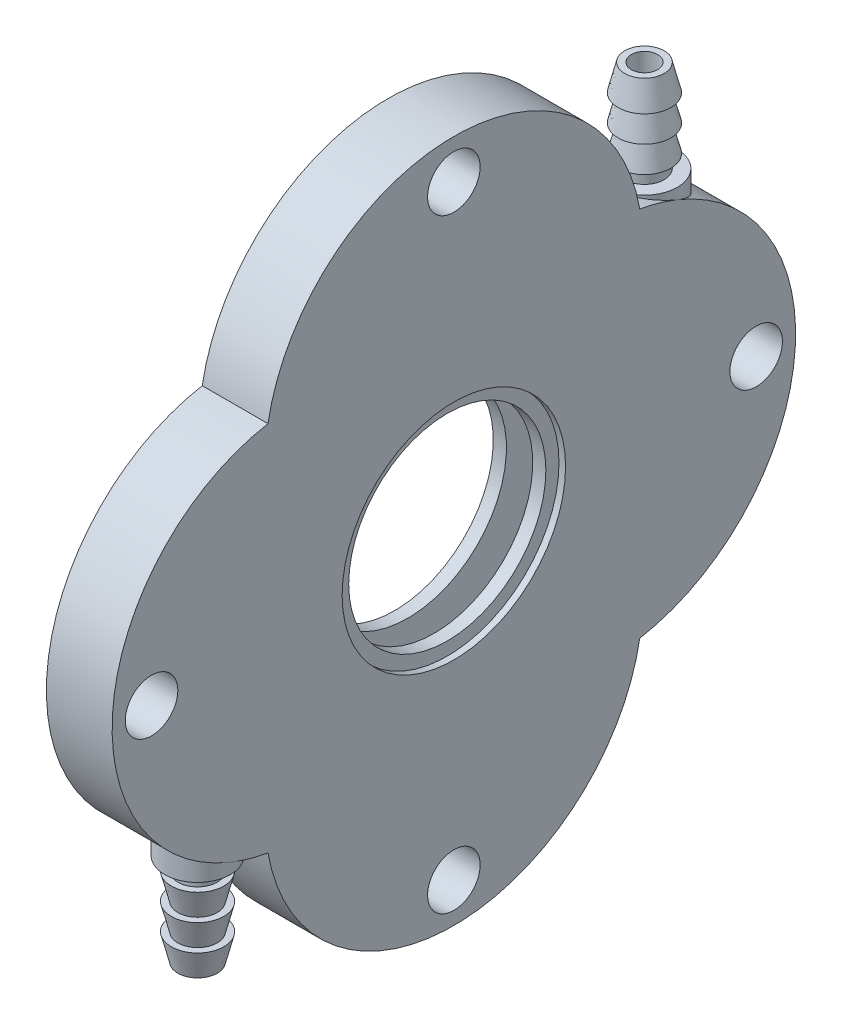
from build123d import *
from build123d.topology import SkipClean

# Parameters (mm, degrees)
SKETCH2_R           = 2
SKETCH2_R_2         = 7.5
BODY_DEPTH          = 2.5
SKETCH3_R           = 8.5
O_RING_SEAT_DEPTH   = 0.5
SKETCH8_R           = 18
CAVITY_DEPTH        = 1
SKETCH5_R           = 1
OUTLET_DEPTH        = 37.854443423
BOSS_EXTRUDE2_REACH = 49.892
SKETCH6_R           = 2.5
SKETCH6_R_2         = 1
INLET_COUNT         = 2


with BuildPart() as part:
    # Sketch2 → Body (new, symmetric)
    with BuildSketch(Plane(origin=(0, 0, 0), x_dir=(0, 0, -1), z_dir=(1, 0, 0))):
        with BuildLine():
            ThreePointArc((-14.142135624, 14.142135624), (-26, 0), (-14.142135624, -14.142135624))
            ThreePointArc((-14.142135624, -14.142135624), (0, -26), (14.142135624, -14.142135624))
            ThreePointArc((14.142135624, -14.142135624), (26, 0), (14.142135624, 14.142135624))
            ThreePointArc((14.142135624, 14.142135624), (0, 26), (-14.142135624, 14.142135624))
        make_face()
        with Locations((0, 23)):
            Circle(SKETCH2_R, mode=Mode.SUBTRACT)
        with Locations((23, 0)):
            Circle(SKETCH2_R, mode=Mode.SUBTRACT)
        with Locations((0, -23)):
            Circle(SKETCH2_R, mode=Mode.SUBTRACT)
        with Locations((-23, 0)):
            Circle(SKETCH2_R, mode=Mode.SUBTRACT)
        Circle(SKETCH2_R_2, mode=Mode.SUBTRACT)
    extrude(amount=BODY_DEPTH, both=True)

    # Sketch3 → O-Ring Seat (cut)
    with BuildSketch(Plane(origin=(2.5, 0, 0), x_dir=(0, 0, -1), z_dir=(1, 0, 0))):
        Circle(SKETCH3_R)
    o_ring_seat = extrude(amount=-O_RING_SEAT_DEPTH, mode=Mode.SUBTRACT)

    # Mirror1: O-Ring Seat across plane
    add(o_ring_seat.mirror(Plane(origin=(0, 0, 0), x_dir=(0, 0, 1), z_dir=(1, 0, 0))), mode=Mode.SUBTRACT)

    # Sketch8 → Cavity (cut, symmetric)
    with BuildSketch(Plane.ZY):
        Circle(SKETCH8_R)
    extrude(amount=CAVITY_DEPTH, both=True, mode=Mode.SUBTRACT)

    # Sketch5 → Outlet (cut, through all)
    with SkipClean():  # the faces are left unmerged after this step: merging them gives an invalid solid
        with BuildSketch(Plane(origin=(0, 0, 0), x_dir=(1, 0, 0), z_dir=(0, 1, 0))):
            with Locations((0, 17)):
                Circle(SKETCH5_R)
        outlet = extrude(amount=OUTLET_DEPTH, mode=Mode.SUBTRACT)

    # Sketch6 → Boss-Extrude2 (add, up to next)
    with BuildSketch(Plane(origin=(0, 14.142135624, 0), x_dir=(1, 0, 0), z_dir=(0, 1, 0)), mode=Mode.PRIVATE) as boss_extrude2_sk1:
        with Locations((0, 17)):
            Circle(SKETCH6_R)
        with Locations((0, 17)):
            Circle(SKETCH6_R_2, mode=Mode.SUBTRACT)
    boss_extrude2_tool1 = extrude(boss_extrude2_sk1.sketch, amount=-BOSS_EXTRUDE2_REACH, mode=Mode.PRIVATE) - part.part
    boss_extrude2 = boss_extrude2_tool1.solids().sort_by_distance((-2.429289, 14.142136, -17))[0]
    add(boss_extrude2)

    # Sketch9 → Revolve1 (revolve)
    with SkipClean():  # the faces are left unmerged after this step: merging them gives an invalid solid
        with BuildSketch(Plane(origin=(0, 0, 0), x_dir=(0, 0, -1), z_dir=(1, 0, 0))):
            Polygon((18, 14.142135624), (18, 21.142135624), (18.5, 21.142135624), (19, 19.142135624), (18.5, 19.142135624), (19, 17.142135624), (18.5, 17.142135624), (19, 15.142135624), (18.5, 15.142135624), (18.5, 14.142135624), align=None)
        revolve1 = revolve(axis=Axis((0, 13.75364771, -17), (0, -1, 0)))

    # Inlet: Outlet, Boss-Extrude2, Revolve1 ×2 about axis
    inlet_axis = Axis((2, 0, 0), (1, 0, 0))
    add([outlet.rotate(inlet_axis, i * 360 / INLET_COUNT) for i in range(1, INLET_COUNT)], mode=Mode.SUBTRACT)
    add([boss_extrude2.rotate(inlet_axis, i * 360 / INLET_COUNT) for i in range(1, INLET_COUNT)])
    add([revolve1.rotate(inlet_axis, i * 360 / INLET_COUNT) for i in range(1, INLET_COUNT)])


solid = part.part
